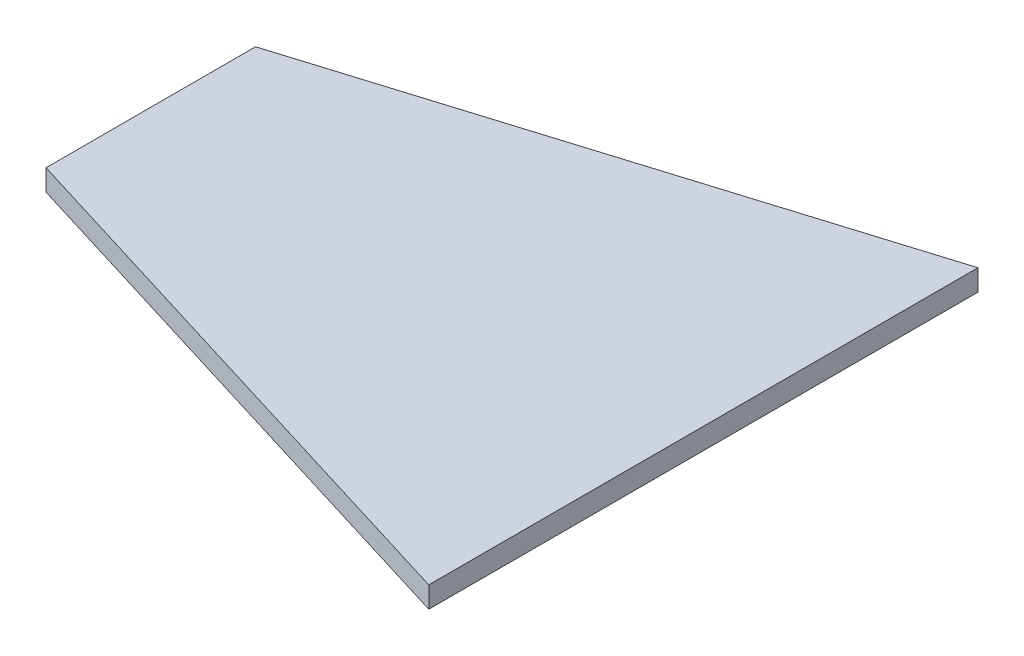
from build123d import *

# Parameters (mm, degrees)
BOSS_EXTRUDE1_DEPTH = 3.175


with BuildPart() as part:
    # Sketch1 → Boss-Extrude1 (new body)
    with BuildSketch(Plane(origin=(0, 0, 0), x_dir=(1, 0, 0), z_dir=(0, 1, 0))):
        Polygon((0, 0), (0, 82.55), (-83.058, 57.023), (-83.058, 25.527), align=None)
    extrude(amount=BOSS_EXTRUDE1_DEPTH)


solid = part.part
